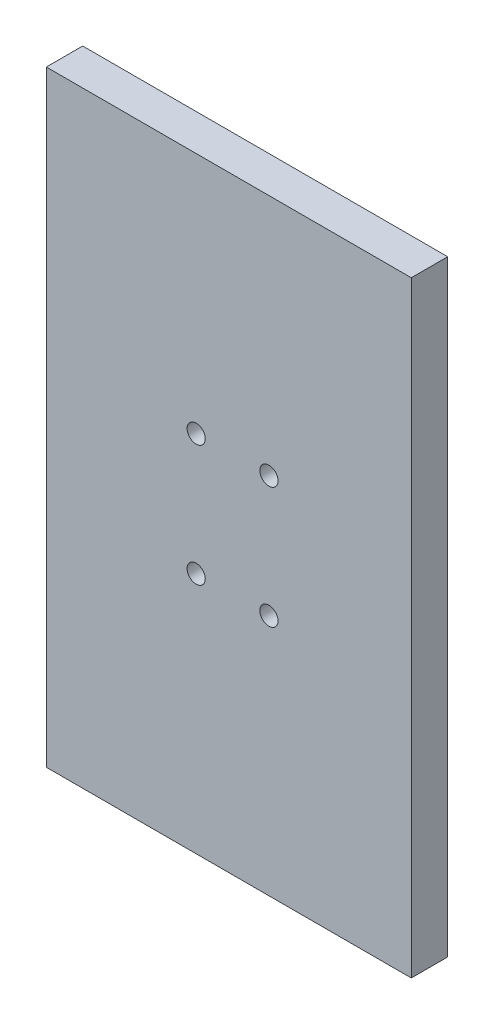
from build123d import *

# Parameters (mm, degrees)
CROQUIS1_W              = 120.365138791
CROQUIS1_H              = 200
SALIENTE_EXTRUIR1_DEPTH = 12
CORTAR_EXTRUIR1_REACH   = 126.056
CROQUIS2_R              = 3


with BuildPart() as part:
    # Croquis1 → Saliente-Extruir1 (new body)
    with BuildSketch(Plane.XY):
        with Locations((-1.236709328, 7.114481003)):
            Rectangle(CROQUIS1_W, CROQUIS1_H)
    extrude(amount=SALIENTE_EXTRUIR1_DEPTH)

    # Croquis2 → Cortar-Extruir1 (cut, up to next)
    with BuildSketch(Plane.XY.offset(12), mode=Mode.PRIVATE) as cortar_extruir1_sk1:
        with Locations((-12, 27.114481003)):
            Circle(CROQUIS2_R)
    cortar_extruir1_tool1 = extrude(cortar_extruir1_sk1.sketch, amount=-CORTAR_EXTRUIR1_REACH, mode=Mode.PRIVATE) & part.part
    # Croquis2 → Cortar-Extruir1 (cut, up to next)
    with BuildSketch(Plane.XY.offset(12), mode=Mode.PRIVATE) as cortar_extruir1_sk2:
        with Locations((12, 27.114481003)):
            Circle(CROQUIS2_R)
    cortar_extruir1_tool2 = extrude(cortar_extruir1_sk2.sketch, amount=-CORTAR_EXTRUIR1_REACH, mode=Mode.PRIVATE) & part.part
    # Croquis2 → Cortar-Extruir1 (cut, up to next)
    with BuildSketch(Plane.XY.offset(12), mode=Mode.PRIVATE) as cortar_extruir1_sk3:
        with Locations((-12, -12.885518997)):
            Circle(CROQUIS2_R)
    cortar_extruir1_tool3 = extrude(cortar_extruir1_sk3.sketch, amount=-CORTAR_EXTRUIR1_REACH, mode=Mode.PRIVATE) & part.part
    # Croquis2 → Cortar-Extruir1 (cut, up to next)
    with BuildSketch(Plane.XY.offset(12), mode=Mode.PRIVATE) as cortar_extruir1_sk4:
        with Locations((12, -12.885518997)):
            Circle(CROQUIS2_R)
    cortar_extruir1_tool4 = extrude(cortar_extruir1_sk4.sketch, amount=-CORTAR_EXTRUIR1_REACH, mode=Mode.PRIVATE) & part.part
    add(cortar_extruir1_tool1.solids().sort_by_distance((-12, 27.114481, 12))[0], mode=Mode.SUBTRACT)
    add(cortar_extruir1_tool2.solids().sort_by_distance((12, 27.114481, 12))[0], mode=Mode.SUBTRACT)
    add(cortar_extruir1_tool3.solids().sort_by_distance((-12, -12.885519, 12))[0], mode=Mode.SUBTRACT)
    add(cortar_extruir1_tool4.solids().sort_by_distance((12, -12.885519, 12))[0], mode=Mode.SUBTRACT)


solid = part.part
